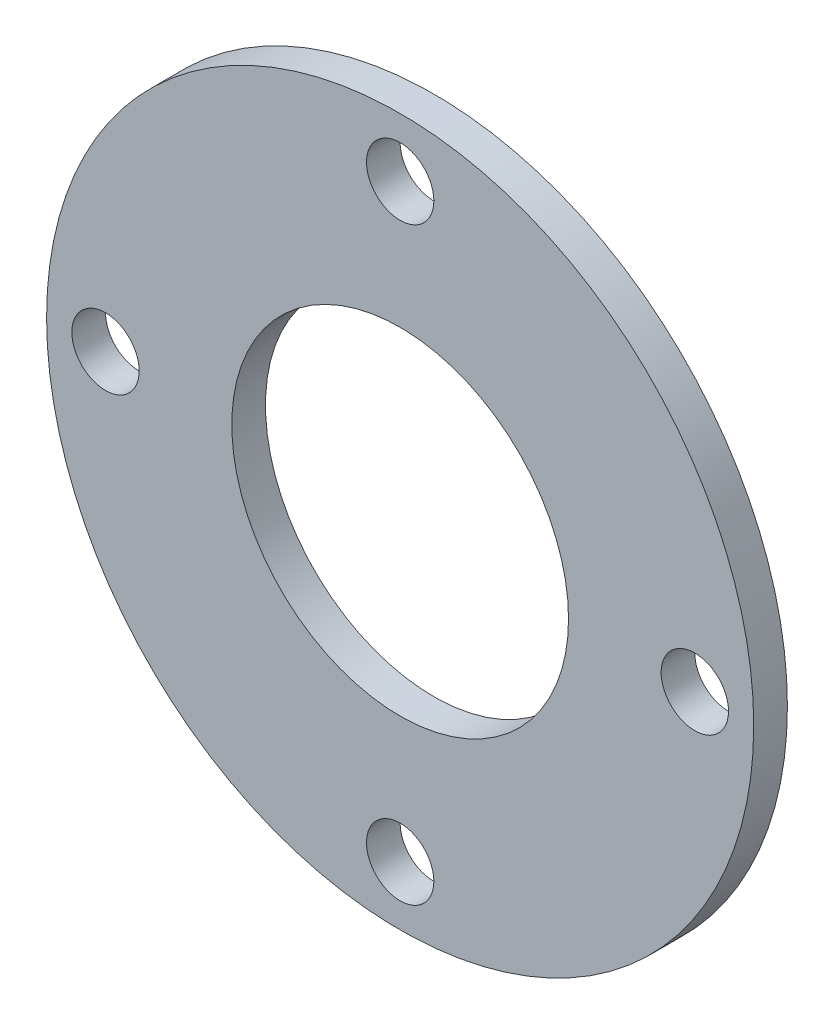
from build123d import *

# Parameters (mm, degrees)
SKETCH_1_R      = 21
SKETCH_1_R_2    = 10
SKETCH_1_R_3    = 2
EXTRUDE_1_DEPTH = 2


with BuildPart() as part:
    # 草图1 → 凸台-拉伸1 (new body)
    with BuildSketch(Plane.XY):
        Circle(SKETCH_1_R)
        Circle(SKETCH_1_R_2, mode=Mode.SUBTRACT)
        with Locations((0, 17.5)):
            Circle(SKETCH_1_R_3, mode=Mode.SUBTRACT)
        with Locations((-17.5, 0)):
            Circle(SKETCH_1_R_3, mode=Mode.SUBTRACT)
        with Locations((0, -17.5)):
            Circle(SKETCH_1_R_3, mode=Mode.SUBTRACT)
        with Locations((17.5, 0)):
            Circle(SKETCH_1_R_3, mode=Mode.SUBTRACT)
    extrude(amount=EXTRUDE_1_DEPTH)


solid = part.part
